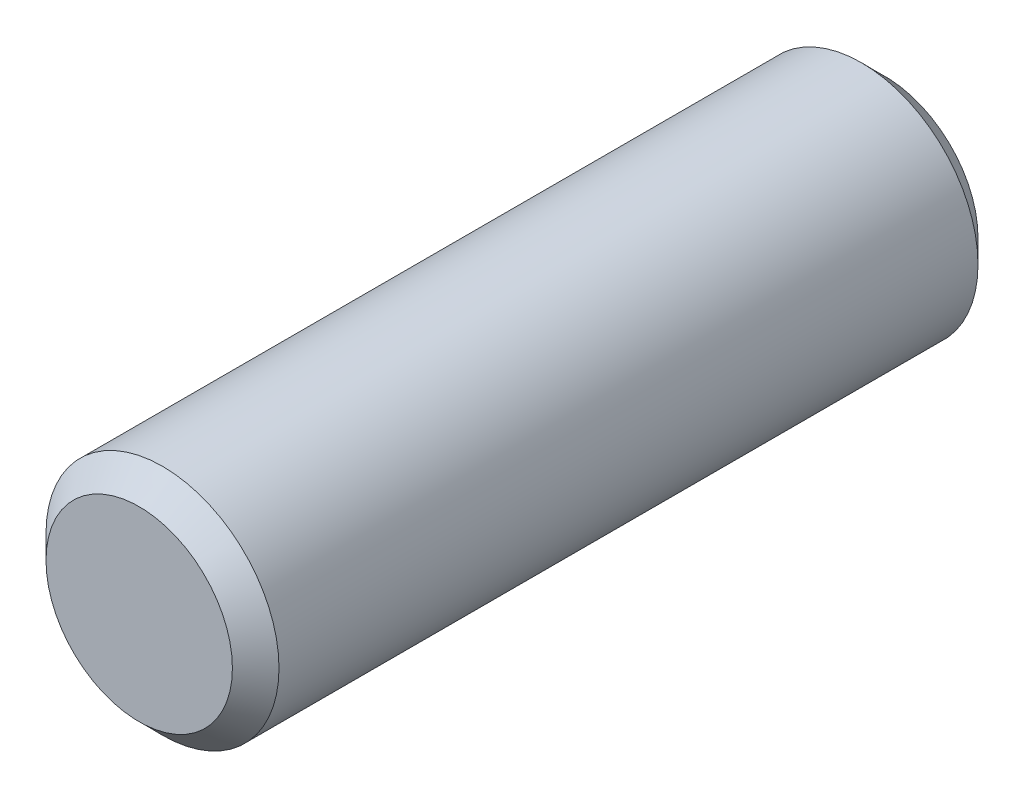
from build123d import *

# Parameters (mm, degrees)
SKETCH2_R           = 5
BOSS_EXTRUDE1_DEPTH = 32
CHAMFER1_SIZE       = 1


with BuildPart() as part:
    # Sketch2 → Boss-Extrude1 (new body)
    with BuildSketch(Plane.XY):
        Circle(SKETCH2_R)
    extrude(amount=BOSS_EXTRUDE1_DEPTH)

    # Chamfer1
    chamfer1_edges = [part.edges().sort_by_distance(p)[0] for p in [
        (-5, 0, 0),
        (-5, 0, 32),
    ]]
    chamfer(chamfer1_edges, length=CHAMFER1_SIZE)


solid = part.part
